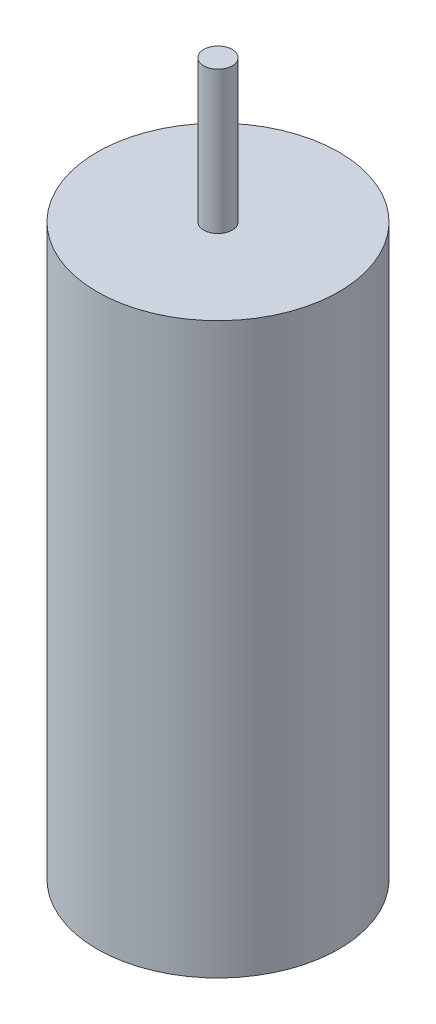
from build123d import *

# Parameters (mm, degrees)
SKETCH1_R           = 4.25
BOSS_EXTRUDE1_DEPTH = 20
SKETCH2_R           = 0.5
BOSS_EXTRUDE2_DEPTH = 5


with BuildPart() as part:
    # Sketch1 → Boss-Extrude1 (new body)
    with BuildSketch(Plane(origin=(0, 0, 0), x_dir=(1, 0, 0), z_dir=(0, 1, 0))):
        with Locations(Location((0, 0, 0), (0, 0, 270))):
            Circle(SKETCH1_R)
    extrude(amount=BOSS_EXTRUDE1_DEPTH)

    # Sketch2 → Boss-Extrude2 (add)
    with BuildSketch(Plane(origin=(0, 20, 0), x_dir=(1, 0, 0), z_dir=(0, 1, 0))):
        with Locations(Location((0, 0, 0), (0, 0, 270))):
            Circle(SKETCH2_R)
    extrude(amount=BOSS_EXTRUDE2_DEPTH)


solid = part.part
